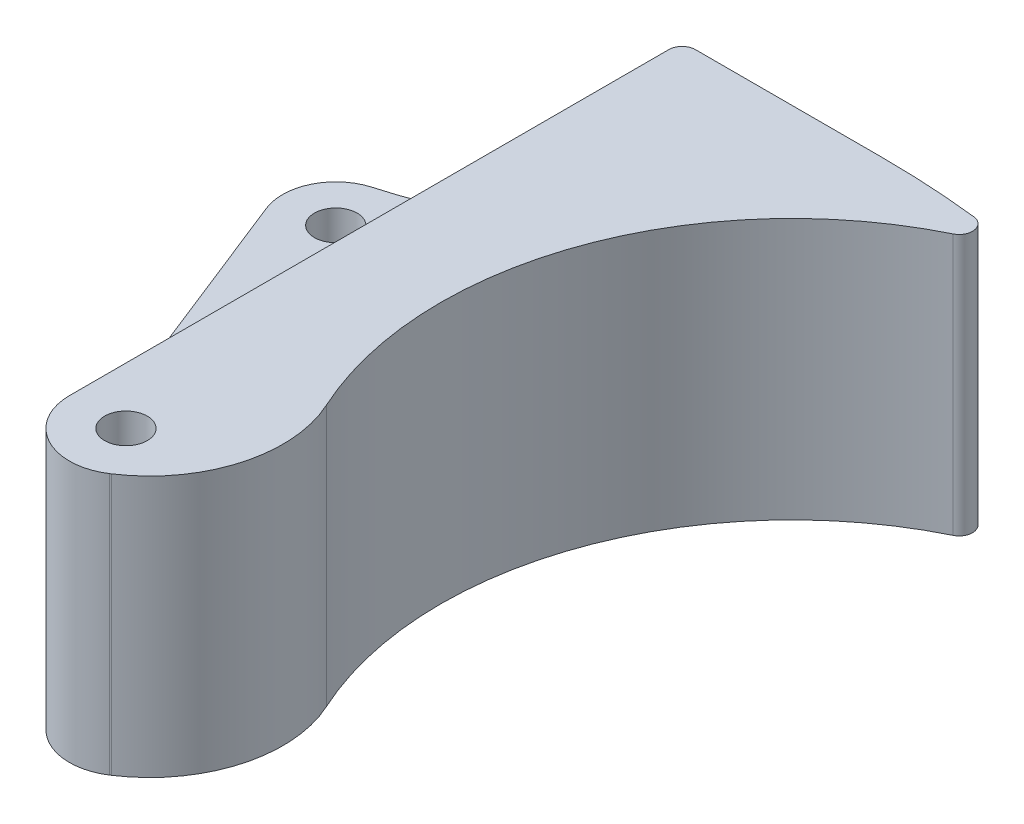
from build123d import *

# Parameters (mm, degrees)
SKETCH1_R           = 2.032
BOSS_EXTRUDE1_DEPTH = 12.446
FILLET2_R           = 12.7
SKETCH2_R           = 2.032
BOSS_EXTRUDE2_DEPTH = 6.19125
FILLET7_R           = 10.16
FILLET8_R           = 1.27


with BuildPart() as part:
    # Sketch1 → Boss-Extrude1 (new, symmetric)
    with BuildSketch(Plane(origin=(0, 0, 0), x_dir=(1, 0, 0), z_dir=(0, 1, 0))):
        with BuildLine():
            Line((2.960934797, -4.512856233), (13.6525, 2.501997733))
            ThreePointArc((13.6525, 2.501997733), (5.644977773, 33.686754268), (27.6225, 57.215416983))
            ThreePointArc((27.6225, 57.215416983), (20.663418632, 58.118296563), (13.6525, 58.42))
            Line((13.6525, 58.42), (-5.3975, 58.42))
            Line((-5.3975, 58.42), (-5.3975, 0))
            ThreePointArc((-5.3975, 0), (-2.56430894, -4.749455328), (2.960934797, -4.512856233))
        make_face()
        with Locations(Location((0, 0, 0), (0, 0, 270))):
            Circle(SKETCH1_R, mode=Mode.SUBTRACT)
    extrude(amount=BOSS_EXTRUDE1_DEPTH, both=True)

    # Fillet2
    fillet2_edges = [part.edges().sort_by_distance(p)[0] for p in [
        (13.6525, 0, -2.501997733),
    ]]
    fillet(fillet2_edges, radius=FILLET2_R)

    # Sketch2 → Boss-Extrude2 (add, symmetric)
    with BuildSketch(Plane(origin=(0, 0, 0), x_dir=(1, 0, 0), z_dir=(0, 1, 0))):
        with BuildLine():
            Line((-5.3975, 40.64), (-14.492103254, 37.881269921))
            ThreePointArc((-14.492103254, 37.881269921), (-17.59286619, 35.227356842), (-17.740238368, 31.148598838))
            Line((-17.740238368, 31.148598838), (-5.3975, 0))
            Line((-5.3975, 0), (-5.3975, 40.64))
        make_face()
        with Locations(Location((-13.0175, 33.02, 0), (0, 0, 270))):
            Circle(SKETCH2_R, mode=Mode.SUBTRACT)
    extrude(amount=BOSS_EXTRUDE2_DEPTH, both=True)

    # Fillet7
    fillet7_edges = [part.edges().sort_by_distance(p)[0] for p in [
        (-5.3975, 0, -40.64),
    ]]
    fillet(fillet7_edges, radius=FILLET7_R)

    # Fillet8
    fillet8_edges = [part.edges().sort_by_distance(p)[0] for p in [
        (-5.3975, 0, -58.42),
        (27.6225, 0, -57.215416983),
    ]]
    fillet(fillet8_edges, radius=FILLET8_R)


solid = part.part
